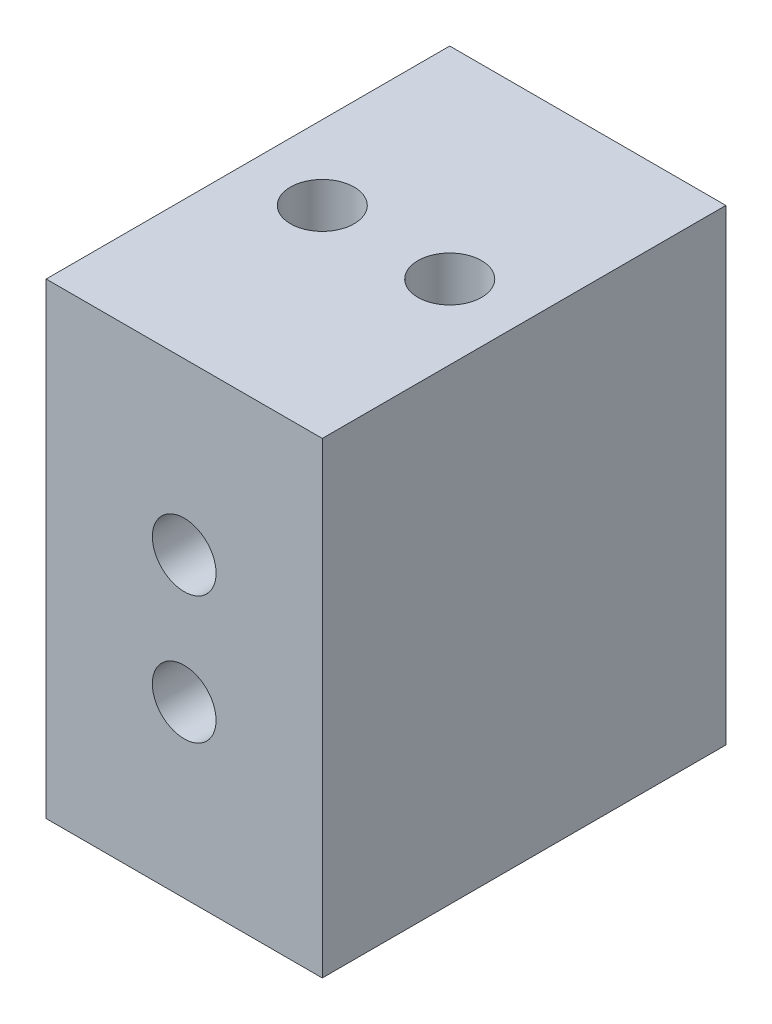
from build123d import *

# Parameters (mm, degrees)
SKETCH1_W           = 13
SKETCH1_H           = 19
BOSS_EXTRUDE1_DEPTH = 22
SKETCH3_R           = 1.5
CUT_EXTRUDE1_DEPTH  = 8
SKETCH4_R           = 1.5
CUT_EXTRUDE2_DEPTH  = 22


with BuildPart() as part:
    # Sketch1 → Boss-Extrude1 (new body)
    with BuildSketch(Plane(origin=(0, 0, 0), x_dir=(1, 0, 0), z_dir=(0, 1, 0))):
        Rectangle(SKETCH1_W, SKETCH1_H)
    extrude(amount=BOSS_EXTRUDE1_DEPTH)

    # Sketch3 → Cut-Extrude1 (cut)
    with BuildSketch(Plane.XY.offset(9.5)):
        with Locations((0, 14)):
            Circle(SKETCH3_R)
        with Locations(Location((0, 8, 0), (0, 0, 180))):
            Circle(SKETCH3_R)
    extrude(amount=-CUT_EXTRUDE1_DEPTH, mode=Mode.SUBTRACT)

    # Sketch4 → Cut-Extrude2 (cut)
    with BuildSketch(Plane(origin=(0, 22, 0), x_dir=(1, 0, 0), z_dir=(0, 1, 0))):
        with Locations(Location((3, 0, 0), (0, 0, 270))):
            Circle(SKETCH4_R)
        with Locations(Location((-3, 0, 0), (0, 0, 270))):
            Circle(SKETCH4_R)
    extrude(amount=-CUT_EXTRUDE2_DEPTH, mode=Mode.SUBTRACT)


solid = part.part
